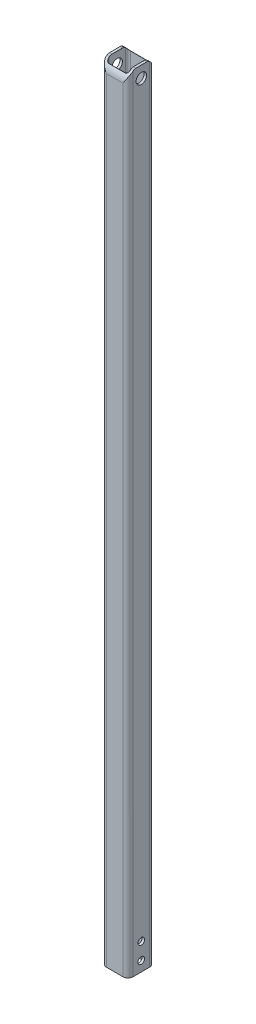
from build123d import *

# Parameters (mm, degrees)
TUBE_SQUARE_TS2X2X0_1875_2_DEPTH = 1500
SKETCH2_R                        = 10
CUT_EXTRUDE1_DEPTH               = 1502.074881543
FILLET1_R                        = 6.35
FILLET2_R                        = 0.127
SKETCH3_R                        = 6.35
CUT_EXTRUDE2_DEPTH               = 1502.074881548


with BuildPart() as part:
    # Sketch1 → Tube (square) TS2X2X0.1875(2) (new body)
    with BuildSketch(Plane(origin=(0, 0, 0), x_dir=(1, 0, 0), z_dir=(0, 1, 0))):
        with BuildLine():
            Line((-15.875, -25.4), (15.875, -25.4))
            ThreePointArc((15.875, -25.4), (22.610192091, -22.610192091), (25.4, -15.875))
            Line((25.4, -15.875), (25.4, 15.875))
            ThreePointArc((25.4, 15.875), (22.610192091, 22.610192091), (15.875, 25.4))
            Line((15.875, 25.4), (-15.875, 25.4))
            ThreePointArc((-15.875, 25.4), (-22.610192091, 22.610192091), (-25.4, 15.875))
            Line((-25.4, 15.875), (-25.4, -15.875))
            ThreePointArc((-25.4, -15.875), (-22.610192091, -22.610192091), (-15.875, -25.4))
        make_face()
        with BuildLine():
            Line((-15.875, -20.6375), (15.875, -20.6375))
            ThreePointArc((15.875, -20.6375), (19.242596045, -19.242596045), (20.6375, -15.875))
            Line((20.6375, -15.875), (20.6375, 15.875))
            ThreePointArc((20.6375, 15.875), (19.242596045, 19.242596045), (15.875, 20.6375))
            Line((15.875, 20.6375), (-15.875, 20.6375))
            ThreePointArc((-15.875, 20.6375), (-19.242596045, 19.242596045), (-20.6375, 15.875))
            Line((-20.6375, 15.875), (-20.6375, -15.875))
            ThreePointArc((-20.6375, -15.875), (-19.242596045, -19.242596045), (-15.875, -20.6375))
        make_face(mode=Mode.SUBTRACT)
    extrude(amount=TUBE_SQUARE_TS2X2X0_1875_2_DEPTH)

    # Sketch2 → Cut-Extrude1 (cut, through all)
    with BuildSketch(Plane(origin=(25.4, 0, 0), x_dir=(0, 0, -1), z_dir=(1, 0, 0))):
        with Locations((0, 1477.775)):
            Circle(SKETCH2_R)
        with BuildLine():
            Line((-25.4, 1477.775), (-25.4, 1500))
            Line((-25.4, 1500), (-12.296722124, 1500))
            ThreePointArc((-12.296722124, 1500), (-21.880319261, 1490.67506314), (-25.4, 1477.775))
        make_face()
        with BuildLine():
            Line((25.4, 1500), (25.4, 1477.775))
            ThreePointArc((25.4, 1477.775), (21.880319261, 1490.67506314), (12.296722124, 1500))
            Line((12.296722124, 1500), (25.4, 1500))
        make_face()
    extrude(amount=-CUT_EXTRUDE1_DEPTH, mode=Mode.SUBTRACT)

    # Fillet1
    fillet1_edges = [part.edges().sort_by_distance(p)[0] for p in [
        (23.01875, 1500, 12.296722124),
        (23.01875, 1500, -12.296722124),
        (-23.01875, 1500, -12.296722124),
        (-23.01875, 1500, 12.296722124),
    ]]
    fillet(fillet1_edges, radius=FILLET1_R)

    # Fillet2
    fillet2_edges = [part.edges().sort_by_distance(p)[0] for p in [
        (20.6375, 1498.29278352, 14.972660399),
        (20.6375, 1500, 0),
        (20.6375, 1499.729662134, -12.363370814),
        (20.6375, 1499.729662134, 12.363370814),
        (-20.6375, 1500, 0),
        (-20.6375, 1498.29278352, -14.972660399),
        (-20.6375, 1499.729662134, -12.363370814),
        (-20.6375, 1499.729662134, 12.363370814),
        (19.435289434, 1494.588907214, -19.038185958),
        (20.6375, 1498.29278352, -14.972660399),
        (-19.435289434, 1494.588907215, -19.038185958),
        (0, 1492.582214247, -20.6375),
        (19.435289434, 1494.588907214, 19.038185958),
        (0, 1492.582214247, 20.6375),
        (-19.435289434, 1494.588907214, 19.038185958),
        (-20.6375, 1498.29278352, 14.972660399),
    ]]
    fillet(fillet2_edges, radius=FILLET2_R)

    # Sketch3 → Cut-Extrude2 (cut, through all)
    with BuildSketch(Plane(origin=(25.4, 0, 0), x_dir=(0, 0, -1), z_dir=(1, 0, 0))):
        with Locations((0, 50.8)):
            Circle(SKETCH3_R)
        with Locations((0, 19.05)):
            Circle(SKETCH3_R)
    extrude(amount=-CUT_EXTRUDE2_DEPTH, mode=Mode.SUBTRACT)


solid = part.part
